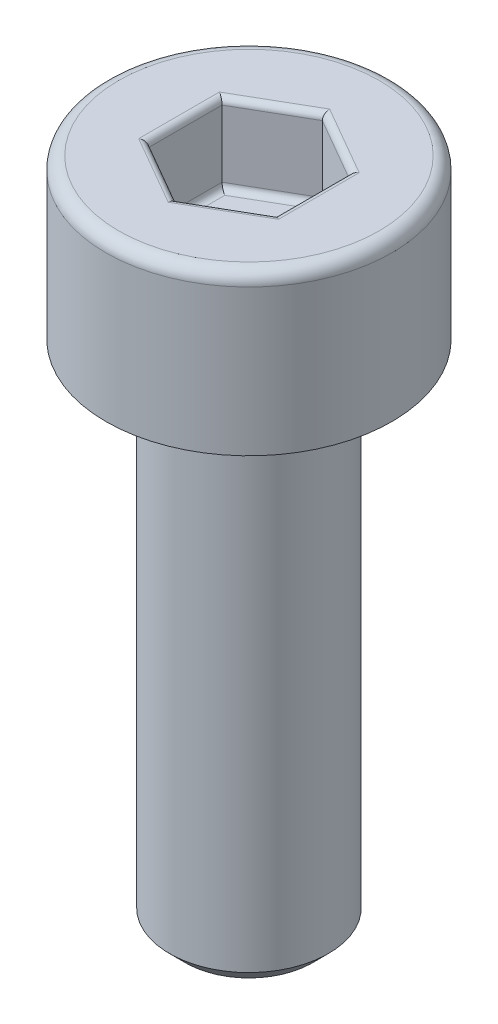
from build123d import *

# Parameters (mm, degrees)
CHAMFER1_SIZE      = 0.25
FILLET1_R          = 0.2
CUT_EXTRUDE1_DEPTH = 1.25
FILLET2_R          = 0.1


with BuildPart() as part:
    # Sketch1 → Revolve1 (revolve)
    with BuildSketch(Plane.XY, mode=Mode.PRIVATE) as revolve1_sk:
        Polygon((0, -10.5), (-1.25, -10.5), (-1.25, -2.5), (-2.25, -2.5), (-2.25, 0), (0, 0), align=None)
    revolve(revolve1_sk.sketch.rotate(Axis((0, 0, 0), (0, -1, 0)), 270), axis=Axis((0, 0, 0), (0, -1, 0)))

    # Chamfer1
    chamfer1_edges = [part.edges().sort_by_distance(p)[0] for p in [
        (0, -2.5, -1.25),
        (0, -10.5, -1.25),
    ]]
    chamfer(chamfer1_edges, length=CHAMFER1_SIZE)

    # Fillet1
    fillet1_edges = [part.edges().sort_by_distance(p)[0] for p in [
        (0, 0, -2.25),
    ]]
    fillet(fillet1_edges, radius=FILLET1_R)

    # Sketch2 → Cut-Extrude1 (cut)
    with BuildSketch(Plane(origin=(0, 0, 0), x_dir=(1, 0, 0), z_dir=(0, 1, 0))):
        Polygon((0, 1.154700538), (-1, 0.577350269), (-1, -0.577350269), (0, -1.154700538), (1, -0.577350269), (1, 0.577350269), align=None)
    extrude(amount=-CUT_EXTRUDE1_DEPTH, mode=Mode.SUBTRACT)

    # Fillet2
    fillet2_edges = [part.edges().sort_by_distance(p)[0] for p in [
        (0.5, -1.25, -0.866025404),
        (1, -1.25, 0),
        (0.5, -1.25, 0.866025404),
        (-0.5, -1.25, 0.866025404),
        (-1, -1.25, 0),
        (-0.5, -1.25, -0.866025404),
        (0.4999999999999987, 0, -0.8660254037844397),
        (-0.5000000000000006, 0, -0.8660254037844395),
        (-1, 0, 0),
        (-0.5000000000000007, 0, 0.8660254037844379),
        (0.4999999999999988, 0, 0.8660254037844382),
        (1, 0, 0),
    ]]
    fillet(fillet2_edges, radius=FILLET2_R)


solid = part.part
